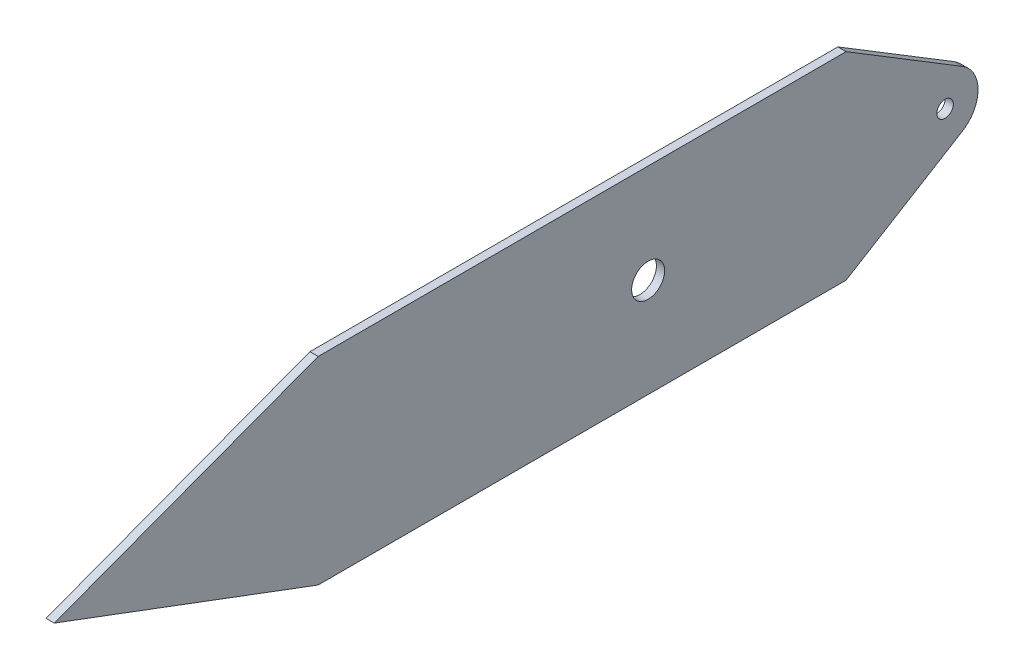
from build123d import *

# Parameters (mm, degrees)
SKETCH1_R           = 6.35
SKETCH1_R_2         = 3.175
BOSS_EXTRUDE1_DEPTH = 3.175


with BuildPart() as part:
    # Sketch1 → Boss-Extrude1 (new body)
    # profile 1 of 2: a face of its own
    with BuildSketch(Plane.YZ):
        Polygon((0, 228.6), (-38.1, 127), (-38.1, -76.2), (-16.334358657, -111.904101294), (-12.7, -97.366666667), (12.7, -97.366666667), (16.334358657, -111.904101294), (38.1, -76.2), (38.1, 127), align=None)
        with Locations(Location((0, 0, 0), (0, 0, 270))):
            Circle(SKETCH1_R, mode=Mode.SUBTRACT)
    # profile 2 of 2: a face of its own
    with BuildSketch(Plane.YZ):
        with BuildLine():
            Line((-12.7, -97.366666667), (-16.334358657, -111.904101294))
            Line((-16.334358657, -111.904101294), (-10.843906908, -120.910573574))
            ThreePointArc((-10.843906908, -120.910573574), (0, -127), (10.843906908, -120.910573574))
            Line((10.843906908, -120.910573574), (16.334358657, -111.904101294))
            Line((16.334358657, -111.904101294), (12.7, -97.366666667))
            Line((12.7, -97.366666667), (-12.7, -97.366666667))
        make_face()
        with Locations(Location((0, -114.3, 0), (0, 0, 270))):
            Circle(SKETCH1_R_2, mode=Mode.SUBTRACT)
    extrude(amount=BOSS_EXTRUDE1_DEPTH)


solid = part.part
